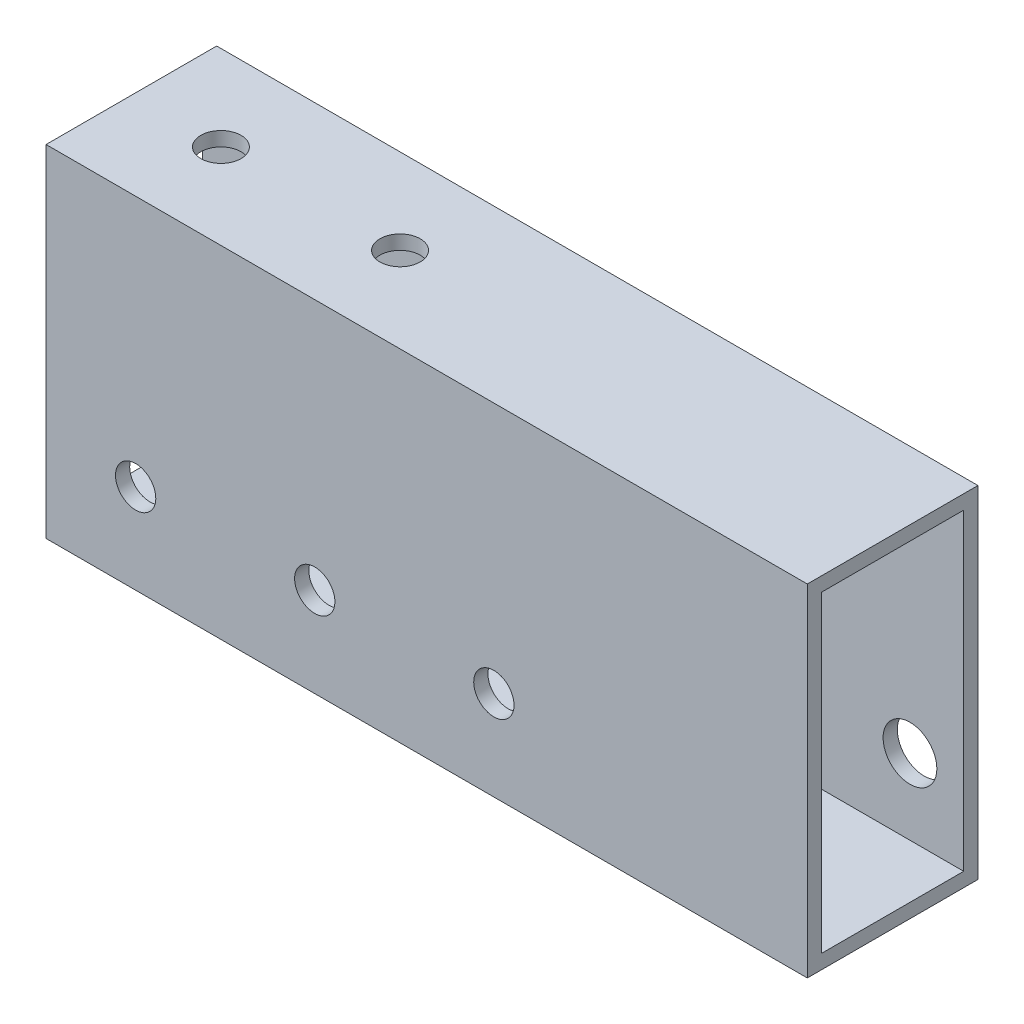
from build123d import *

# Parameters (mm, degrees)
EXTRUDE_THIN1_START            = -40
SKETCH1_W                      = 38.1
SKETCH1_H                      = 76.2
SKETCH1_W_2                    = 31.75
SKETCH1_H_2                    = 69.85
EXTRUDE_THIN1_DEPTH            = 170
M8_CLEARANCE_HOLE2_D           = 9
M8_CLEARANCE_HOLE3_D           = 9
F_12_0_12_DIAMETER_HOLE1_D     = 12
F_12_0_12_DIAMETER_HOLE1_DEPTH = 3.175


with BuildPart() as part:
    # Sketch1 → Extrude-Thin1 (new body)
    with BuildSketch(Plane(origin=(0, 0, 0), x_dir=(0, 0, -1), z_dir=(1, 0, 0)).offset(EXTRUDE_THIN1_START)):
        Rectangle(SKETCH1_W, SKETCH1_H)
        Rectangle(SKETCH1_W_2, SKETCH1_H_2, mode=Mode.SUBTRACT)
    extrude(amount=EXTRUDE_THIN1_DEPTH)

    # M8 Clearance Hole2 (through all)
    with Locations(Plane(origin=(0, 0, -19.05), x_dir=(-1, 0, 0), z_dir=(0, 0, -1))):
        with Locations((20, -18.1), (-20, -18.1), (-60, -18.1)):
            Hole(M8_CLEARANCE_HOLE2_D / 2)

    # M8 Clearance Hole3 (through all)
    with Locations(Plane(origin=(0, -38.1, 0), x_dir=(-1, 0, 0), z_dir=(0, -1, 0))):
        with Locations((-20, 0), (20, 0)):
            Hole(M8_CLEARANCE_HOLE3_D / 2)

    # Ø12.0 (12) Diameter Hole1
    with Locations(Plane(origin=(0, 0, -19.05), x_dir=(-1, 0, 0), z_dir=(0, 0, -1))):
        with Locations((-118, -18.1), (-82, -18.1)):
            Hole(F_12_0_12_DIAMETER_HOLE1_D / 2, depth=F_12_0_12_DIAMETER_HOLE1_DEPTH)


solid = part.part
